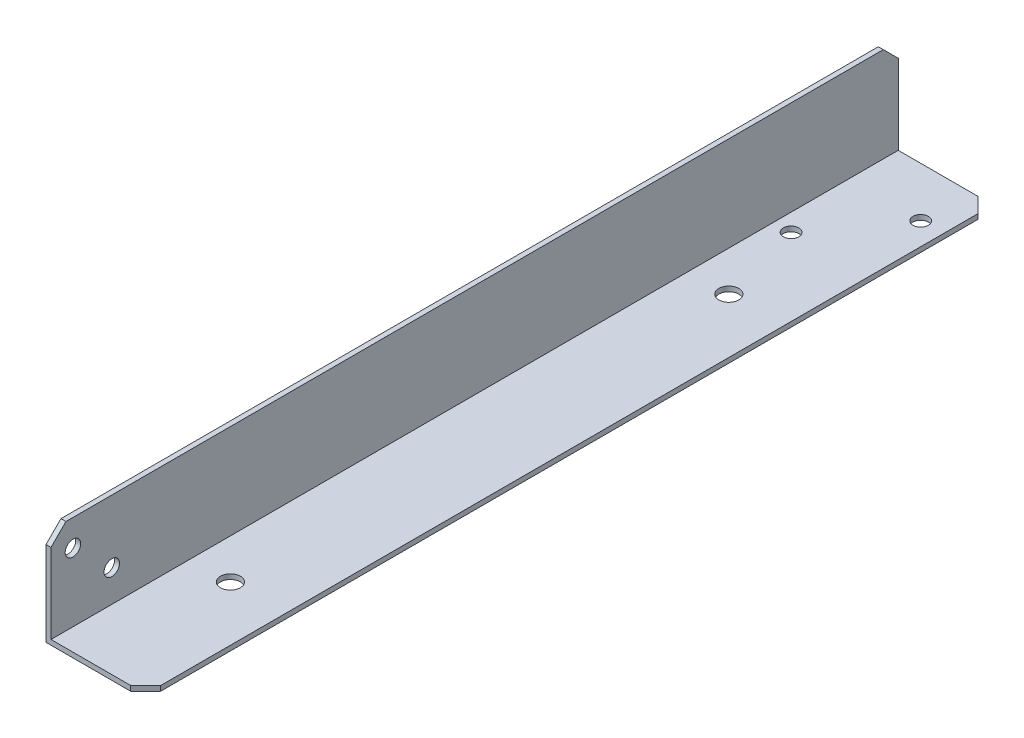
from build123d import *

# Parameters (mm, degrees)
BASE_DEPTH           = 170
CHAMFER1_SIZE        = 3
SKETCH4_R            = 1.55
CARRIAGESIDE_DEPTH   = 173.002906952
SKETCH6_R            = 1.55
CABLECHAINSIDE_DEPTH = 1
SKETCH7_R            = 2
CUT_EXTRUDE1_DEPTH   = 173.336879396


with BuildPart() as part:
    # Sketch1 → Base (new body)
    with BuildSketch(Plane.XY):
        Polygon((0, 0), (20, 0), (20, 1), (1, 1), (1, 20), (0, 20), align=None)
    extrude(amount=BASE_DEPTH)

    # Chamfer1
    chamfer1_edges = [part.edges().sort_by_distance(p)[0] for p in [
        (20, 0.5, 170),
        (0.5, 20, 170),
        (0.5, 20, 0),
        (20, 0.5, 0),
    ]]
    chamfer(chamfer1_edges, length=CHAMFER1_SIZE)

    # Sketch4 → CarriageSide (cut, through all)
    with BuildSketch(Plane(origin=(2, 1, 0), x_dir=(0, 0, -1), z_dir=(0, 1, 0))):
        with Locations(Location((-10, -13.5, 0), (0, 0, 90))):
            Circle(SKETCH4_R)
        with Locations(Location((-25, -2.5, 0), (0, 0, 90))):
            Circle(SKETCH4_R)
    extrude(amount=-CARRIAGESIDE_DEPTH, mode=Mode.SUBTRACT)

    # Sketch6 → CableChainSide (cut)
    with BuildSketch(Plane(origin=(1, 0, 0), x_dir=(0, 0, -1), z_dir=(1, 0, 0))):
        with Locations(Location((-165.6, 14.68, 0), (0, 0, 90))):
            Circle(SKETCH6_R)
        with Locations(Location((-157.8, 7.38, 0), (0, 0, 90))):
            Circle(SKETCH6_R)
    extrude(amount=-CABLECHAINSIDE_DEPTH, mode=Mode.SUBTRACT)

    # Sketch7 → Cut-Extrude1 (cut, through all)
    with BuildSketch(Plane.XZ):
        with Locations(Location((9, 142, 0), (0, 0, 270))):
            Circle(SKETCH7_R)
        with Locations(Location((9, 42, 0), (0, 0, 270))):
            Circle(SKETCH7_R)
    extrude(amount=-CUT_EXTRUDE1_DEPTH, mode=Mode.SUBTRACT)


solid = part.part
